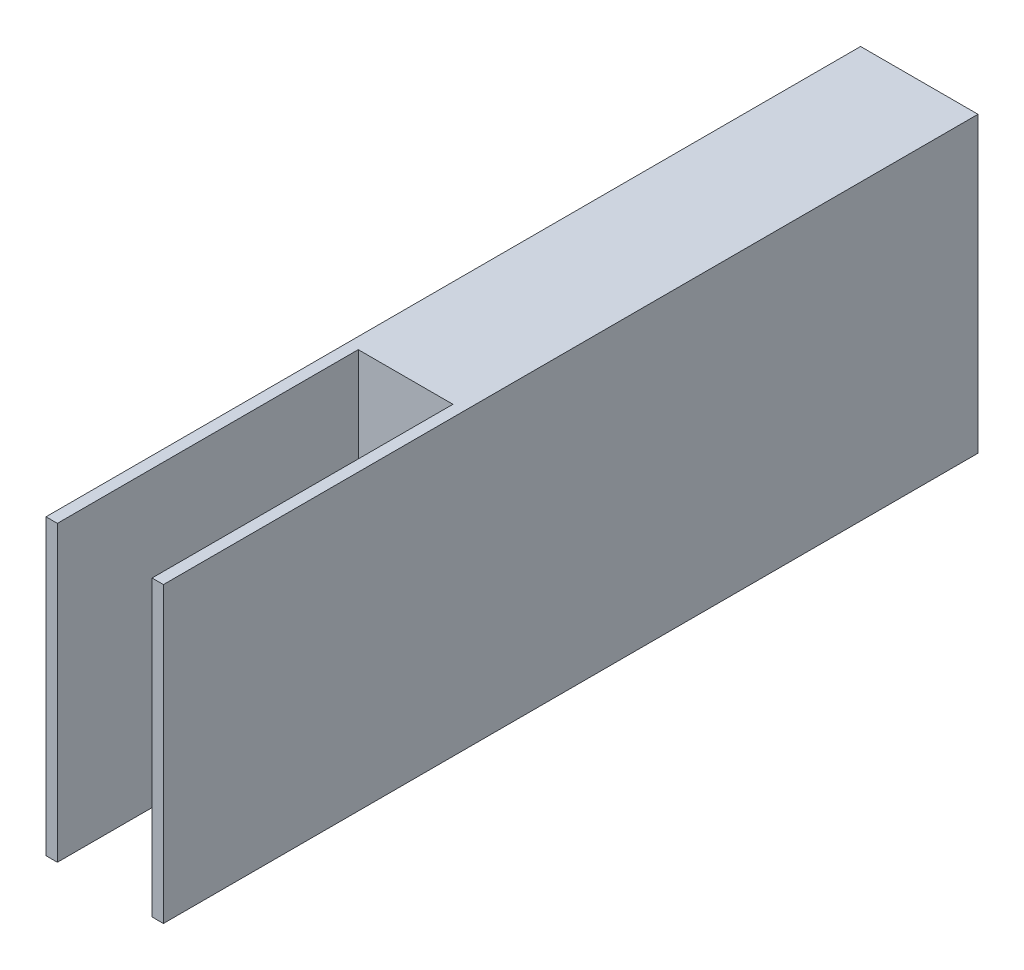
from build123d import *

# Parameters (mm, degrees)
ESQUISSE1_W        = 8
ESQUISSE1_H        = 20
BOSS_EXTRU_1_DEPTH = 35
ESQUISSE3_W        = 0.775
ESQUISSE3_H        = 20
BOSS_EXTRU_2_DEPTH = 20.5


with BuildPart() as part:
    # Esquisse1 → Boss.-Extru.1 (new body)
    with BuildSketch(Plane.XY):
        with Locations((-0.369362761, -3.517391304)):
            Rectangle(ESQUISSE1_W, ESQUISSE1_H)
    extrude(amount=BOSS_EXTRU_1_DEPTH)

    # Esquisse3 → Boss.-Extru.2 (add)
    with BuildSketch(Plane.XY.offset(35)):
        with Locations((-3.981862761, -3.517391304)):
            Rectangle(ESQUISSE3_W, ESQUISSE3_H)
        with Locations((3.243137239, -3.517391304)):
            Rectangle(ESQUISSE3_W, ESQUISSE3_H)
    extrude(amount=BOSS_EXTRU_2_DEPTH)


solid = part.part
